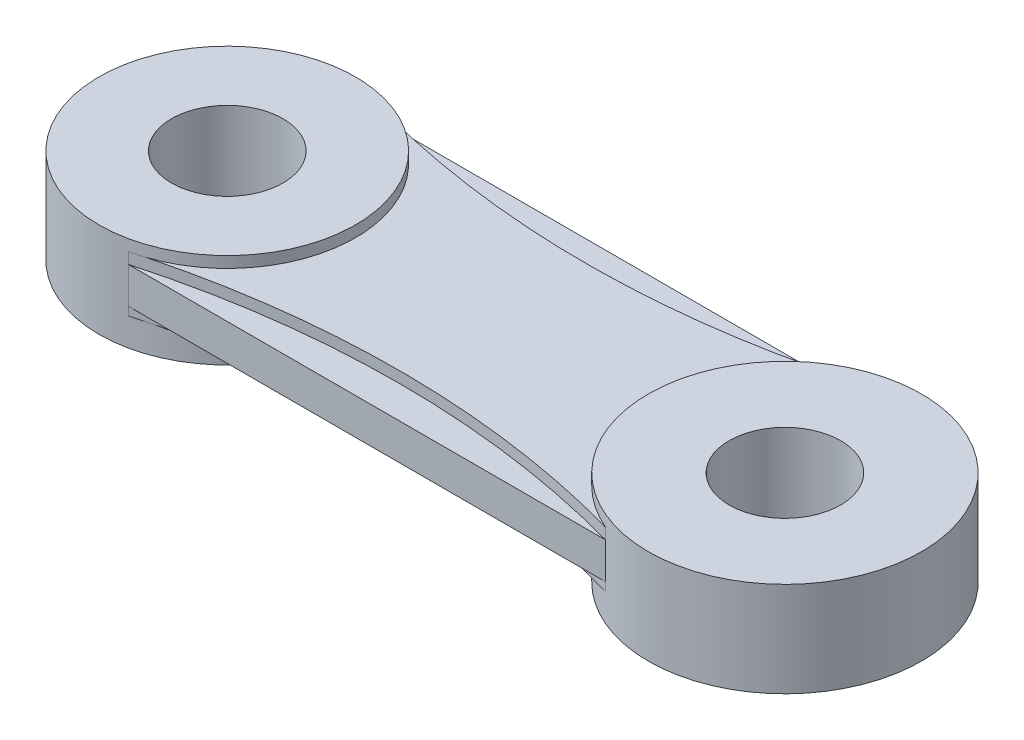
from build123d import *

# Parameters (mm, degrees)
CROQUIS3_W                   = 1000
CROQUIS3_H                   = 450
SALIENTE_EXTRUIR4_DEPTH      = 100
SALIENTE_EXTRUIR5_DEPTH      = 20
SALIENTE_EXTRUIR5_DEPTH_BACK = 150
CROQUIS6_R                   = 245
CROQUIS6_R_2                 = 230
CORTAR_EXTRUIR5_DEPTH        = 20
CORTAR_EXTRUIR4_DEPTH        = 1342.575566265
CORTAR_EXTRUIR4_DEPTH_BACK   = 1342.575566265
CROQUIS8_R                   = 100
CORTAR_EXTRUIR6_START        = -15
CORTAR_EXTRUIR6_DEPTH        = 15


with BuildPart() as part:
    # Croquis3 → Saliente-Extruir4 (new body)
    with BuildSketch(Plane(origin=(0, 0, 0), x_dir=(1, 0, 0), z_dir=(0, 1, 0))):
        with Locations((500, 225)):
            Rectangle(CROQUIS3_W, CROQUIS3_H)
    extrude(amount=SALIENTE_EXTRUIR4_DEPTH)

    # Croquis6 → Saliente-Extruir5 (add, two sides: drawn at the far end of the back side and taken through both)
    with BuildSketch(Plane(origin=(0, 100, 0), x_dir=(1, 0, 0), z_dir=(0, 1, 0)).offset(-SALIENTE_EXTRUIR5_DEPTH_BACK)):
        with Locations(Location((1000, 225, 0), (0, 0, 270))):
            Circle(CROQUIS6_R)
        with Locations(Location((0, 225, 0), (0, 0, 270))):
            Circle(CROQUIS6_R_2)
    extrude(amount=SALIENTE_EXTRUIR5_DEPTH + SALIENTE_EXTRUIR5_DEPTH_BACK)

    # Croquis7 → Cortar-Extruir5 (cut)
    with BuildSketch(Plane(origin=(0, 100, 0), x_dir=(1, 0, 0), z_dir=(0, 1, 0))):
        with BuildLine():
            Line((47.696960071, 0), (903.046402852, 0))
            ThreePointArc((903.046402852, 0), (475.371681461, 58.217157741), (47.696960071, 0))
        make_face()
        with BuildLine():
            Line((47.696960071, 450), (903.046402852, 450))
            ThreePointArc((903.046402852, 450), (475.371681461, 391.782842259), (47.696960071, 450))
        make_face()
    extrude(amount=-CORTAR_EXTRUIR5_DEPTH, mode=Mode.SUBTRACT)

    # Croquis8 → Cortar-Extruir4 (cut, two sides: drawn at the far end of the back side and taken through both)
    with BuildSketch(Plane(origin=(0, 120, 0), x_dir=(1, 0, 0), z_dir=(0, 1, 0)).offset(-CORTAR_EXTRUIR4_DEPTH_BACK)):
        with Locations(Location((0, 225, 0), (0, 0, 270))):
            Circle(CROQUIS8_R)
        with Locations(Location((1000, 225, 0), (0, 0, 270))):
            Circle(CROQUIS8_R)
    extrude(amount=CORTAR_EXTRUIR4_DEPTH + CORTAR_EXTRUIR4_DEPTH_BACK, mode=Mode.SUBTRACT)

    # Croquis9 → Cortar-Extruir6 (cut)
    with BuildSketch(Plane.XZ.offset(CORTAR_EXTRUIR6_START)):
        with BuildLine():
            Line((47.696960071, 0), (903.046402852, 0))
            ThreePointArc((903.046402852, 0), (475.371681461, -58.217157741), (47.696960071, 0))
        make_face()
        with BuildLine():
            Line((47.696960071, -450), (903.046402852, -450))
            ThreePointArc((903.046402852, -450), (475.371681461, -391.782842259), (47.696960071, -450))
        make_face()
    extrude(amount=CORTAR_EXTRUIR6_DEPTH, mode=Mode.SUBTRACT)


solid = part.part
